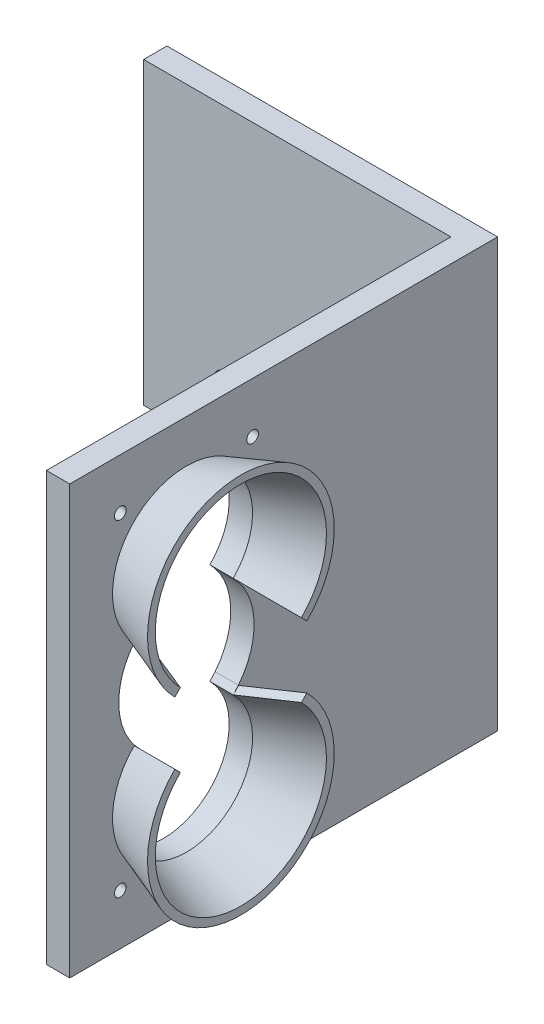
from build123d import *

# Parameters (mm, degrees)
EXTRUDE_1_DEPTH       = 27.5
SKETCH_3_R            = 0.75
CUT_EXTRUDE_3_DEPTH   = 3
REVOLVE_1_ANGLE       = 135
MIRROR_3_COPY_1_ANGLE = 135
MIRROR_3_COPY_2_ANGLE = 135
SKETCH_2_R            = 1.5
SKETCH_2_W            = 20
SKETCH_2_H            = 16.5
CUT_EXTRUDE_4_DEPTH   = 3


with BuildPart() as part:
    # 草图1 → 凸台-拉伸1 (new, symmetric)
    with BuildSketch(Plane(origin=(0, 0, 0), x_dir=(1, 0, 0), z_dir=(0, 1, 0))):
        Polygon((-16.617647059, 27.284313725), (25.882352941, 27.284313725), (25.882352941, -27.715686275), (22.882352941, -27.715686275), (22.882352941, 24.284313725), (-16.617647059, 24.284313725), align=None)
    extrude(amount=EXTRUDE_1_DEPTH, both=True)

    # 草图3 → 切除-拉伸3 (cut)
    with BuildSketch(Plane(origin=(25.882352941, 0, 0), x_dir=(0, 0, -1), z_dir=(1, 0, 0))):
        with BuildLine():
            ThreePointArc((-19.394463571, 5.743970558), (-21.414171084, 0), (-19.394463571, -5.743970558))
            Line((-19.394463571, -5.743970558), (-18.726093915, -6.48959236))
            ThreePointArc((-18.726093915, -6.48959236), (-12.715686275, -21), (-6.705278634, -6.48959236))
            Line((-6.705278634, -6.48959236), (-6.036908978, -5.743970558))
            ThreePointArc((-6.036908978, -5.743970558), (-4.017201465, 0), (-6.036908978, 5.743970558))
            Line((-6.036908978, 5.743970558), (-6.705278634, 6.48959236))
            ThreePointArc((-6.705278634, 6.48959236), (-12.715686275, 21), (-18.726093915, 6.48959236))
            Line((-18.726093915, 6.48959236), (-19.394463571, 5.743970558))
        make_face()
        with Locations((-4.215686275, -21)):
            Circle(SKETCH_3_R)
        with Locations((-21.215686275, -21)):
            Circle(SKETCH_3_R)
        with Locations((-4.215686275, 21)):
            Circle(SKETCH_3_R)
        with Locations((-21.215686275, 21)):
            Circle(SKETCH_3_R)
    extrude(amount=-CUT_EXTRUDE_3_DEPTH, mode=Mode.SUBTRACT)

    # 草图5 → 旋转1 (revolve)
    with BuildSketch(Plane(origin=(0, 0, 12.715686275), x_dir=(0, -1, 0), z_dir=(0, 0, 1))):
        Polygon((-22, 25.882352941), (-24.5, 32.882352941), (-23.5, 32.882352941), (-21, 25.882352941), align=None)
    revolve_1 = revolve(axis=Axis((32.882352941, 12.5, 12.715686275), (-1, 0, 0)), revolution_arc=REVOLVE_1_ANGLE)

    # 镜向1: 旋转1 across plane
    add(revolve_1.mirror(Plane.ZX))

    # 镜向2: 旋转1 across plane
    add(revolve_1.mirror(Plane.XY.offset(12.715686275)))

    # 镜向3 copy 1 sketch → 镜向3 copy 1 (revolve)
    with BuildSketch(Plane.YX.offset(-12.715686275)):
        Polygon((-22, 25.882352941), (-24.5, 32.882352941), (-23.5, 32.882352941), (-21, 25.882352941), align=None)
    revolve(axis=Axis((32.882352941, -12.5, 12.715686275), (-1, 0, 0)), revolution_arc=MIRROR_3_COPY_1_ANGLE)

    # 镜向3 copy 2 sketch → 镜向3 copy 2 (revolve)
    with BuildSketch(Plane(origin=(0, 0, 12.715686275), x_dir=(0, -1, 0), z_dir=(0, 0, -1))):
        Polygon((-22, -25.882352941), (-24.5, -32.882352941), (-23.5, -32.882352941), (-21, -25.882352941), align=None)
    revolve(axis=Axis((32.882352941, 12.5, 12.715686275), (1, 0, 0)), revolution_arc=MIRROR_3_COPY_2_ANGLE)

    # 草图2 → 切除-拉伸4 (cut)
    with BuildSketch(Plane(origin=(0, 0, -27.284313725), x_dir=(-1, 0, 0), z_dir=(0, 0, -1))):
        with Locations((6.117647059, -3.5)):
            Circle(SKETCH_2_R)
        with Locations((-13.882352941, -3.5)):
            Circle(SKETCH_2_R)
        with Locations((6.617647059, -19.25)):
            Rectangle(SKETCH_2_W, SKETCH_2_H)
    extrude(amount=-CUT_EXTRUDE_4_DEPTH, mode=Mode.SUBTRACT)


solid = part.part
